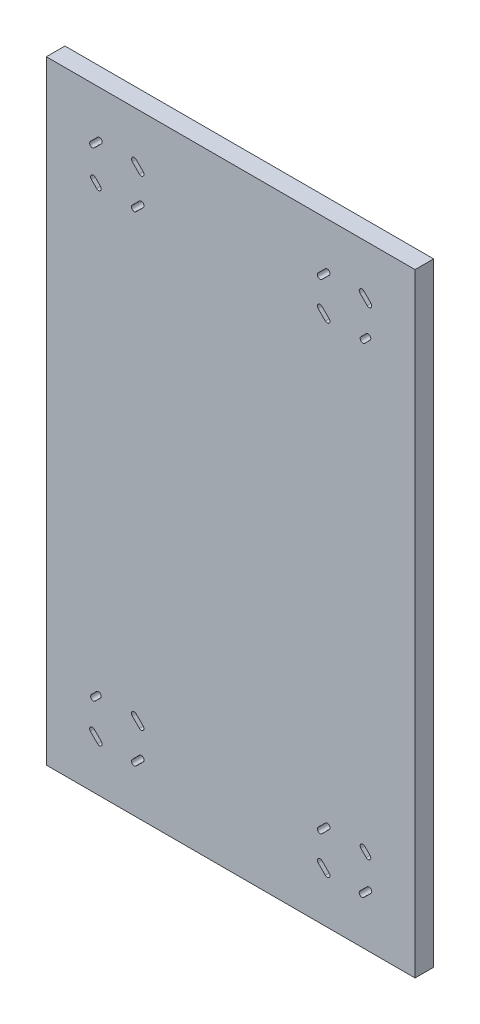
from build123d import *

# Parameters (mm, degrees)
SKETCH1_W           = 755.65
SKETCH1_H           = 1257.3
BOSS_EXTRUDE1_DEPTH = 38.1
CUT_EXTRUDE3_DEPTH  = 735.441395296


with BuildPart() as part:
    # Sketch1 → Boss-Extrude1 (new body)
    with BuildSketch(Plane.XY):
        Rectangle(SKETCH1_W, SKETCH1_H)
    extrude(amount=BOSS_EXTRUDE1_DEPTH)

    # Sketch6 → Cut-Extrude3 (cut, through all)
    with BuildSketch(Plane.XY.offset(38.1)):
        with BuildLine():
            Line((287.450320151, -523.682403955), (272.857403955, -538.275320151))
            ThreePointArc((272.857403955, -538.275320151), (264.999679849, -538.275320151), (264.999679849, -530.417596045))
            Line((264.999679849, -530.417596045), (279.592596045, -515.824679849))
            ThreePointArc((279.592596045, -515.824679849), (287.450320151, -515.824679849), (287.450320151, -523.682403955))
        make_face()
        with BuildLine():
            Line((-287.450320151, -523.682403955), (-272.857403955, -538.275320151))
            ThreePointArc((-272.857403955, -538.275320151), (-264.999679849, -538.275320151), (-264.999679849, -530.417596045))
            Line((-264.999679849, -530.417596045), (-279.592596045, -515.824679849))
            ThreePointArc((-279.592596045, -515.824679849), (-287.450320151, -515.824679849), (-287.450320151, -523.682403955))
        make_face()
        with BuildLine():
            Line((-193.867596045, -538.275320151), (-179.274679849, -523.682403955))
            ThreePointArc((-179.274679849, -523.682403955), (-179.274679849, -515.824679849), (-187.132403955, -515.824679849))
            Line((-187.132403955, -515.824679849), (-201.725320151, -530.417596045))
            ThreePointArc((-201.725320151, -530.417596045), (-201.725320151, -538.275320151), (-193.867596045, -538.275320151))
        make_face()
        with BuildLine():
            Line((-274.821834981, -446.351610875), (-285.485889125, -457.015665019))
            ThreePointArc((-285.485889125, -457.015665019), (-285.485889125, -464.873389125), (-277.628165019, -464.873389125))
            Line((-277.628165019, -464.873389125), (-266.964110875, -454.209334981))
            ThreePointArc((-266.964110875, -454.209334981), (-266.964110875, -446.351610875), (-274.821834981, -446.351610875))
        make_face()
        with BuildLine():
            Line((193.867596045, -538.275320151), (179.274679849, -523.682403955))
            ThreePointArc((179.274679849, -523.682403955), (179.274679849, -515.824679849), (187.132403955, -515.824679849))
            Line((187.132403955, -515.824679849), (201.725320151, -530.417596045))
            ThreePointArc((201.725320151, -530.417596045), (201.725320151, -538.275320151), (193.867596045, -538.275320151))
        make_face()
        with BuildLine():
            Line((274.821834981, -446.351610875), (285.485889125, -457.015665019))
            ThreePointArc((285.485889125, -457.015665019), (285.485889125, -464.873389125), (277.628165019, -464.873389125))
            Line((277.628165019, -464.873389125), (266.964110875, -454.209334981))
            ThreePointArc((266.964110875, -454.209334981), (266.964110875, -446.351610875), (274.821834981, -446.351610875))
        make_face()
        with BuildLine():
            Line((201.725320151, -453.397436213), (187.132403955, -467.99035241))
            ThreePointArc((187.132403955, -467.99035241), (179.274679849, -467.99035241), (179.274679849, -460.132628304))
            Line((179.274679849, -460.132628304), (193.867596045, -445.539712107))
            ThreePointArc((193.867596045, -445.539712107), (201.725320151, -445.539712107), (201.725320151, -453.397436213))
        make_face()
        with BuildLine():
            Line((-201.725320151, -453.397436213), (-187.132403955, -467.99035241))
            ThreePointArc((-187.132403955, -467.99035241), (-179.274679849, -467.99035241), (-179.274679849, -460.132628304))
            Line((-179.274679849, -460.132628304), (-193.867596045, -445.539712107))
            ThreePointArc((-193.867596045, -445.539712107), (-201.725320151, -445.539712107), (-201.725320151, -453.397436213))
        make_face()
        with BuildLine():
            Line((287.450320151, 523.682403955), (272.857403955, 538.275320151))
            ThreePointArc((272.857403955, 538.275320151), (264.999679849, 538.275320151), (264.999679849, 530.417596045))
            Line((264.999679849, 530.417596045), (279.592596045, 515.824679849))
            ThreePointArc((279.592596045, 515.824679849), (287.450320151, 515.824679849), (287.450320151, 523.682403955))
        make_face()
        with BuildLine():
            Line((193.867596045, 538.275320151), (179.274679849, 523.682403955))
            ThreePointArc((179.274679849, 523.682403955), (179.274679849, 515.824679849), (187.132403955, 515.824679849))
            Line((187.132403955, 515.824679849), (201.725320151, 530.417596045))
            ThreePointArc((201.725320151, 530.417596045), (201.725320151, 538.275320151), (193.867596045, 538.275320151))
        make_face()
        with BuildLine():
            Line((-287.450320151, 523.682403955), (-272.857403955, 538.275320151))
            ThreePointArc((-272.857403955, 538.275320151), (-264.999679849, 538.275320151), (-264.999679849, 530.417596045))
            Line((-264.999679849, 530.417596045), (-279.592596045, 515.824679849))
            ThreePointArc((-279.592596045, 515.824679849), (-287.450320151, 515.824679849), (-287.450320151, 523.682403955))
        make_face()
        with BuildLine():
            Line((-193.867596045, 538.275320151), (-179.274679849, 523.682403955))
            ThreePointArc((-179.274679849, 523.682403955), (-179.274679849, 515.824679849), (-187.132403955, 515.824679849))
            Line((-187.132403955, 515.824679849), (-201.725320151, 530.417596045))
            ThreePointArc((-201.725320151, 530.417596045), (-201.725320151, 538.275320151), (-193.867596045, 538.275320151))
        make_face()
        with BuildLine():
            Line((-274.821834981, 446.351610875), (-285.485889125, 457.015665019))
            ThreePointArc((-285.485889125, 457.015665019), (-285.485889125, 464.873389125), (-277.628165019, 464.873389125))
            Line((-277.628165019, 464.873389125), (-266.964110875, 454.209334981))
            ThreePointArc((-266.964110875, 454.209334981), (-266.964110875, 446.351610875), (-274.821834981, 446.351610875))
        make_face()
        with BuildLine():
            Line((274.821834981, 446.351610875), (285.485889125, 457.015665019))
            ThreePointArc((285.485889125, 457.015665019), (285.485889125, 464.873389125), (277.628165019, 464.873389125))
            Line((277.628165019, 464.873389125), (266.964110875, 454.209334981))
            ThreePointArc((266.964110875, 454.209334981), (266.964110875, 446.351610875), (274.821834981, 446.351610875))
        make_face()
        with BuildLine():
            Line((201.725320151, 453.397436213), (187.132403955, 467.99035241))
            ThreePointArc((187.132403955, 467.99035241), (179.274679849, 467.99035241), (179.274679849, 460.132628304))
            Line((179.274679849, 460.132628304), (193.867596045, 445.539712107))
            ThreePointArc((193.867596045, 445.539712107), (201.725320151, 445.539712107), (201.725320151, 453.397436213))
        make_face()
        with BuildLine():
            Line((-201.725320151, 453.397436213), (-187.132403955, 467.99035241))
            ThreePointArc((-187.132403955, 467.99035241), (-179.274679849, 467.99035241), (-179.274679849, 460.132628304))
            Line((-179.274679849, 460.132628304), (-193.867596045, 445.539712107))
            ThreePointArc((-193.867596045, 445.539712107), (-201.725320151, 445.539712107), (-201.725320151, 453.397436213))
        make_face()
    extrude(amount=-CUT_EXTRUDE3_DEPTH, mode=Mode.SUBTRACT)


solid = part.part
